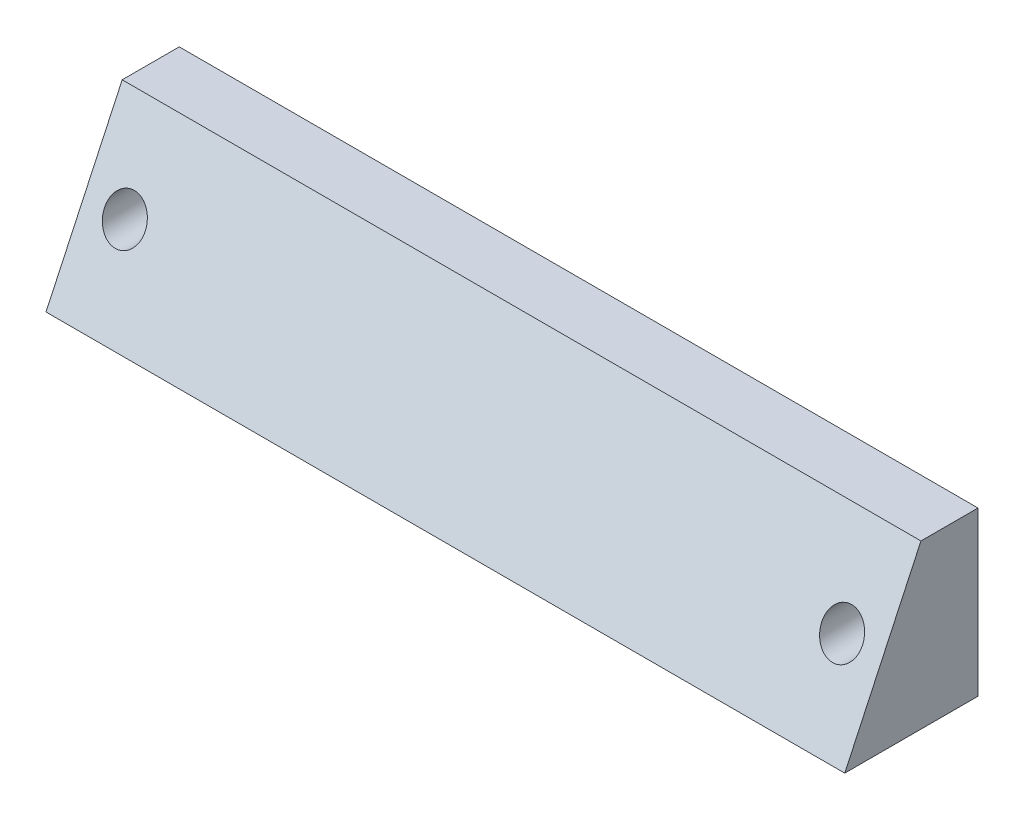
from build123d import *

# Parameters (mm, degrees)
SKETCH_1_W          = 98
SKETCH_1_H          = 20
EXTRUDE_1_DEPTH     = 7
EXTRUDE_2_DEPTH     = 98
CUT_EXTRUDE_START   = -6
SKETCH_3_R          = 2.5
SKETCH_3_R_2        = 1.5
CUT_EXTRUDE_3_DEPTH = 98
SKETCH_4_R          = 1.5
CUT_EXTRUDE_6_DEPTH = 98


with BuildPart() as part:
    # 草图1 → 凸台-拉伸1 (new body)
    with BuildSketch(Plane.XY):
        with Locations((0.769633508, 15.397905759)):
            Rectangle(SKETCH_1_W, SKETCH_1_H)
    extrude(amount=EXTRUDE_1_DEPTH)

    # 草图2 → 凸台-拉伸2 (add)
    with BuildSketch(Plane.ZY.offset(48.230366492)):
        Polygon((7, 25.397905759), (7, 5.397905759), (12.864294632, 5.397905759), (16.347940075, 5.397905759), align=None)
    extrude(amount=-EXTRUDE_2_DEPTH)

    # 草图3 → 切除-拉伸3 (cut)
    # profile 1 of 2: a face of its own
    with BuildSketch(Plane(origin=(0, 0, 0), x_dir=(-1, 0, 0), z_dir=(0, 0, -1)).offset(CUT_EXTRUDE_START)):
        with Locations((-44.769633508, 15.397905759)):
            Circle(SKETCH_3_R)
    # profile 2 of 2: a face of its own
    with BuildSketch(Plane(origin=(0, 0, 0), x_dir=(-1, 0, 0), z_dir=(0, 0, -1)).offset(CUT_EXTRUDE_START)):
        with Locations((43.230366492, 15.397905759)):
            Circle(SKETCH_3_R)
        with Locations((43.230366492, 15.397905759)):
            Circle(SKETCH_3_R_2, mode=Mode.SUBTRACT)
    extrude(amount=-CUT_EXTRUDE_3_DEPTH, mode=Mode.SUBTRACT)

    # 草图4 → 切除-拉伸6 (cut)
    with BuildSketch(Plane.XY):
        with Locations(Location((-43.230366492, 15.397905759, 0), (0, 0, 180))):
            Circle(SKETCH_4_R)
        with Locations(Location((44.769633508, 15.397905759, 0), (0, 0, 180))):
            Circle(SKETCH_4_R)
    extrude(amount=CUT_EXTRUDE_6_DEPTH, mode=Mode.SUBTRACT)


solid = part.part
